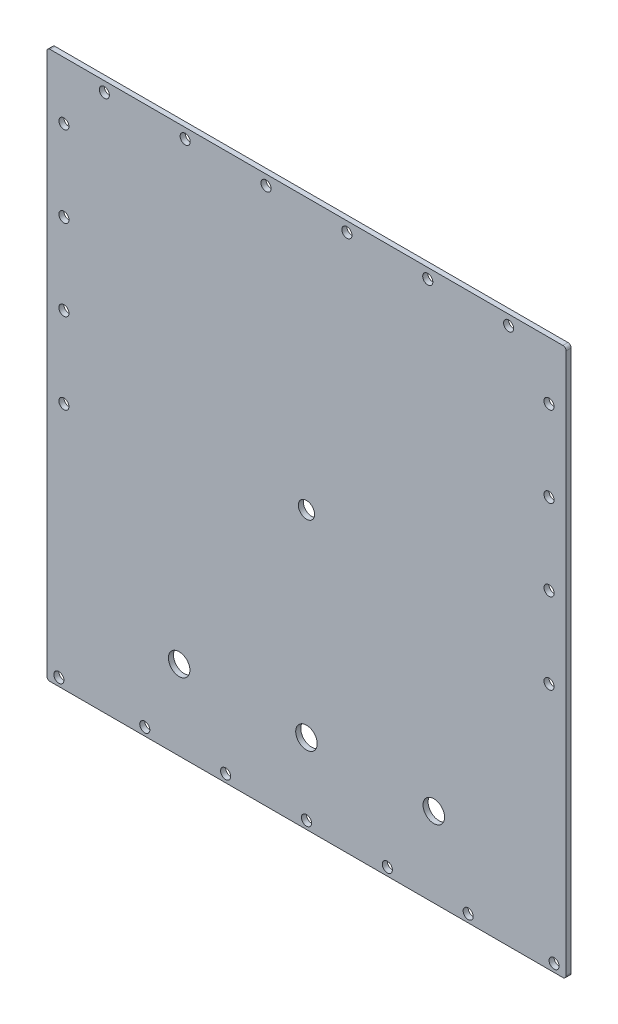
from build123d import *

# Parameters (mm, degrees)
SKETCH2_W               = 163.1
SKETCH2_H               = 171.98
SKETCH2_R               = 2.5527
SKETCH2_R_2             = 1.5875
BOSS_EXTRUDE2_DEPTH     = 1.5875
FILLET1_R               = 1
CUT_EXTRUDE1_DEPTH      = 238.715061694
CUT_EXTRUDE1_DEPTH_BACK = 238.715061694
SKETCH3_R               = 3.38


with BuildPart() as part:
    # Sketch2 → Boss-Extrude2 (new body)
    with BuildSketch(Plane.XY):
        with Locations((82.55, -85.99)):
            Rectangle(SKETCH2_W, SKETCH2_H)
        with Locations((82.55, -85)):
            Circle(SKETCH2_R, mode=Mode.SUBTRACT)
        with Locations((82.55, -169.48)):
            Circle(SKETCH2_R_2, mode=Mode.SUBTRACT)
        with Locations((4.7625, -169.48)):
            Circle(SKETCH2_R_2, mode=Mode.SUBTRACT)
        with Locations((31.75, -169.48)):
            Circle(SKETCH2_R_2, mode=Mode.SUBTRACT)
        with Locations((57.15, -169.48)):
            Circle(SKETCH2_R_2, mode=Mode.SUBTRACT)
        with Locations((6.35, -94.25)):
            Circle(SKETCH2_R_2, mode=Mode.SUBTRACT)
        with Locations((6.35, -68.85)):
            Circle(SKETCH2_R_2, mode=Mode.SUBTRACT)
        with Locations((6.35, -43.45)):
            Circle(SKETCH2_R_2, mode=Mode.SUBTRACT)
        with Locations((6.35, -18.05)):
            Circle(SKETCH2_R_2, mode=Mode.SUBTRACT)
        with Locations((19.05, -3.175)):
            Circle(SKETCH2_R_2, mode=Mode.SUBTRACT)
        with Locations((44.45, -3.175)):
            Circle(SKETCH2_R_2, mode=Mode.SUBTRACT)
        with Locations((69.85, -3.175)):
            Circle(SKETCH2_R_2, mode=Mode.SUBTRACT)
        with Locations((158.75, -43.45)):
            Circle(SKETCH2_R_2, mode=Mode.SUBTRACT)
        with Locations((158.75, -18.05)):
            Circle(SKETCH2_R_2, mode=Mode.SUBTRACT)
        with Locations((146.05, -3.175)):
            Circle(SKETCH2_R_2, mode=Mode.SUBTRACT)
        with Locations((107.95, -169.48)):
            Circle(SKETCH2_R_2, mode=Mode.SUBTRACT)
        with Locations((133.35, -169.48)):
            Circle(SKETCH2_R_2, mode=Mode.SUBTRACT)
        with Locations((160.3375, -169.48)):
            Circle(SKETCH2_R_2, mode=Mode.SUBTRACT)
        with Locations((158.75, -94.25)):
            Circle(SKETCH2_R_2, mode=Mode.SUBTRACT)
        with Locations((158.75, -68.85)):
            Circle(SKETCH2_R_2, mode=Mode.SUBTRACT)
        with Locations((95.25, -3.175)):
            Circle(SKETCH2_R_2, mode=Mode.SUBTRACT)
        with Locations((120.65, -3.175)):
            Circle(SKETCH2_R_2, mode=Mode.SUBTRACT)
    extrude(amount=BOSS_EXTRUDE2_DEPTH)

    # Fillet1
    fillet1_edges = [part.edges().sort_by_distance(p)[0] for p in [
        (1, -171.98, 0.79375),
        (1, 0, 0.79375),
        (164.1, 0, 0.79375),
        (164.1, -171.98, 0.79375),
    ]]
    fillet(fillet1_edges, radius=FILLET1_R)

    # Sketch3 → Cut-Extrude1 (cut, two sides: drawn at the far end of the back side and taken through both)
    with BuildSketch(Plane.XY.offset(1.5875).offset(-CUT_EXTRUDE1_DEPTH_BACK)):
        with Locations((42.55, -146.97212)):
            Circle(SKETCH3_R)
        with Locations((82.55, -146.97212)):
            Circle(SKETCH3_R)
        with Locations((122.55, -146.97212)):
            Circle(SKETCH3_R)
    extrude(amount=CUT_EXTRUDE1_DEPTH + CUT_EXTRUDE1_DEPTH_BACK, mode=Mode.SUBTRACT)


solid = part.part
